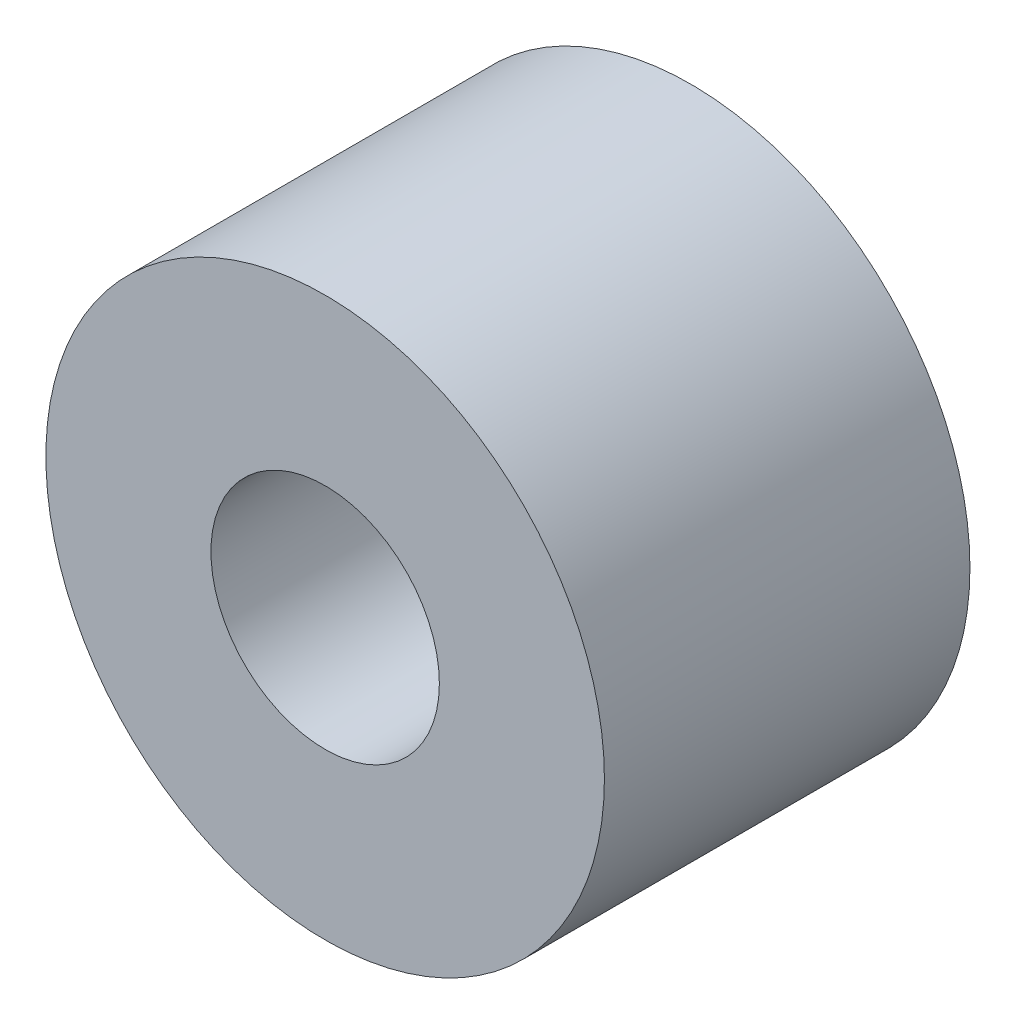
from build123d import *

# Parameters (mm, degrees)
SKETCH1_R           = 6.112197724
SKETCH1_R_2         = 2.5
BOSS_EXTRUDE1_DEPTH = 8


with BuildPart() as part:
    # Sketch1 → Boss-Extrude1 (new body)
    with BuildSketch(Plane.XY.offset(334)):
        with Locations((300, 300)):
            Circle(SKETCH1_R)
        with Locations((300, 300)):
            Circle(SKETCH1_R_2, mode=Mode.SUBTRACT)
    extrude(amount=BOSS_EXTRUDE1_DEPTH)


solid = part.part
